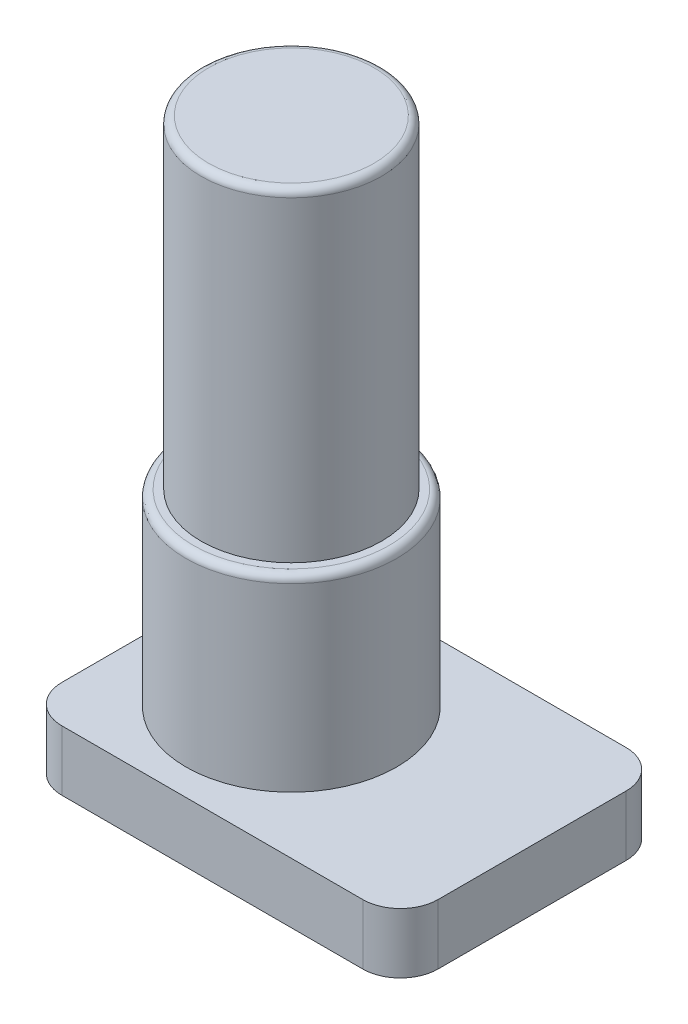
from build123d import *

# Parameters (mm, degrees)
SKETCH1_W           = 50
SKETCH1_H           = 35
BOSS_EXTRUDE1_DEPTH = 8
SKETCH2_R           = 14
BOSS_EXTRUDE2_DEPTH = 25
SKETCH3_R           = 12
BOSS_EXTRUDE3_DEPTH = 43
FILLET1_R           = 5
FILLET2_R           = 1


with BuildPart() as part:
    # Sketch1 → Boss-Extrude1 (new body)
    with BuildSketch(Plane(origin=(0, 0, 0), x_dir=(1, 0, 0), z_dir=(0, 1, 0))):
        Rectangle(SKETCH1_W, SKETCH1_H)
    extrude(amount=BOSS_EXTRUDE1_DEPTH)

    # Sketch2 → Boss-Extrude2 (add)
    with BuildSketch(Plane(origin=(0, 8, 0), x_dir=(1, 0, 0), z_dir=(0, 1, 0))):
        with Locations(Location((-7, 0, 0), (0, 0, 270))):
            Circle(SKETCH2_R)
    extrude(amount=BOSS_EXTRUDE2_DEPTH)

    # Sketch3 → Boss-Extrude3 (add)
    with BuildSketch(Plane(origin=(0, 33, 0), x_dir=(1, 0, 0), z_dir=(0, 1, 0))):
        with Locations(Location((-7, 0, 0), (0, 0, 270))):
            Circle(SKETCH3_R)
    extrude(amount=BOSS_EXTRUDE3_DEPTH)

    # Fillet1
    fillet1_edges = [part.edges().sort_by_distance(p)[0] for p in [
        (25, 4, 17.5),
        (-25, 4, 17.5),
        (-25, 4, -17.5),
        (25, 4, -17.5),
    ]]
    fillet(fillet1_edges, radius=FILLET1_R)

    # Fillet2
    fillet2_edges = [part.edges().sort_by_distance(p)[0] for p in [
        (-7, 33, -14),
        (-7, 76, -12),
    ]]
    fillet(fillet2_edges, radius=FILLET2_R)


solid = part.part
